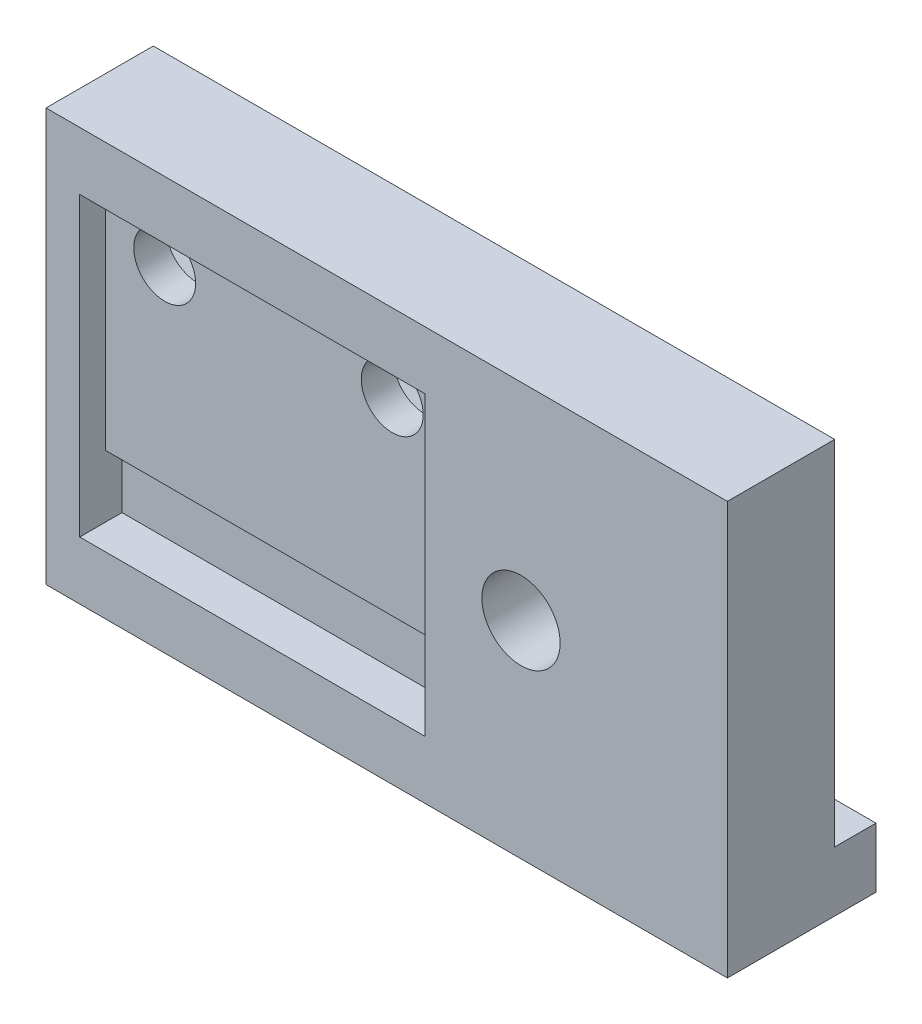
from build123d import *
from build123d.topology import SkipClean

# Parameters (mm, degrees)
SKETCH1_W           = 41.925
SKETCH1_H           = 25.4
SKETCH1_R           = 1.9039967
SKETCH1_R_2         = 2.40665
BOSS_EXTRUDE1_DEPTH = 2
SKETCH2_W           = 41.925
SKETCH2_H           = 25.4
SKETCH2_R           = 2.40665
SKETCH2_W_2         = 21.254
SKETCH2_H_2         = 18.254
BOSS_EXTRUDE2_DEPTH = 1.6
BOSS_EXTRUDE3_START = 3
SKETCH3_W           = 41.925
SKETCH3_H           = 25.4
SKETCH3_R           = 2.40665
BOSS_EXTRUDE3_DEPTH = 3
SKETCH4_W           = 41.925
SKETCH4_H           = 3.683
BOSS_EXTRUDE4_DEPTH = 2.54
SKETCH5_W           = 21.254
SKETCH5_H           = 3.81
CUT_EXTRUDE1_DEPTH  = 1


with BuildPart() as part:
    # Sketch1 → Boss-Extrude1 (new body)
    with BuildSketch(Plane.XY):
        with Locations((20.9625, 12.7)):
            Rectangle(SKETCH1_W, SKETCH1_H)
        with Locations((5.7, 19.05)):
            Circle(SKETCH1_R, mode=Mode.SUBTRACT)
        with Locations((19.7, 19.05)):
            Circle(SKETCH1_R, mode=Mode.SUBTRACT)
        with Locations((29.225, 12.7)):
            Circle(SKETCH1_R_2, mode=Mode.SUBTRACT)
    extrude(amount=BOSS_EXTRUDE1_DEPTH)

    # Sketch2 → Boss-Extrude2 (add)
    with BuildSketch(Plane.XY.offset(2)):
        with Locations((20.9625, 12.7)):
            Rectangle(SKETCH2_W, SKETCH2_H)
        with Locations((29.225, 12.7)):
            Circle(SKETCH2_R, mode=Mode.SUBTRACT)
        with Locations((12.7, 12.7)):
            Rectangle(SKETCH2_W_2, SKETCH2_H_2, mode=Mode.SUBTRACT)
    extrude(amount=BOSS_EXTRUDE2_DEPTH)

    # Sketch3 → Boss-Extrude3 (add)
    with SkipClean():  # the faces are left unmerged after this step: merging them gives an invalid solid
        with BuildSketch(Plane(origin=(0, 0, 0), x_dir=(-1, 0, 0), z_dir=(0, 0, -1)).offset(BOSS_EXTRUDE3_START)):
            with Locations((-20.9625, 12.7)):
                Rectangle(SKETCH3_W, SKETCH3_H)
            with Locations((-29.225, 12.7)):
                Circle(SKETCH3_R, mode=Mode.SUBTRACT)
            Polygon((-16.5690055, 17.242319483), (-16.5690055, 20.857680517), (-19.7, 22.665361035), (-22.8309945, 20.857680517), (-22.8309945, 17.242319483), (-19.7, 15.434638965), align=None, mode=Mode.SUBTRACT)
            Polygon((-2.5690055, 20.857680517), (-5.7, 22.665361035), (-8.8309945, 20.857680517), (-8.8309945, 17.242319483), (-5.7, 15.434638965), (-2.5690055, 17.242319483), align=None, mode=Mode.SUBTRACT)
        extrude(amount=-BOSS_EXTRUDE3_DEPTH)

    # Sketch4 → Boss-Extrude4 (add)
    with SkipClean():  # the faces are left unmerged after this step: merging them gives an invalid solid
        with BuildSketch(Plane(origin=(0, 0, -3), x_dir=(-1, 0, 0), z_dir=(0, 0, -1))):
            with Locations((-20.9625, 1.8415)):
                Rectangle(SKETCH4_W, SKETCH4_H)
        extrude(amount=BOSS_EXTRUDE4_DEPTH)

    # Sketch5 → Cut-Extrude1 (cut)
    with SkipClean():  # the faces are left unmerged after this step: merging them gives an invalid solid
        with BuildSketch(Plane.XY.offset(2)):
            with Locations((12.7, 5.478)):
                Rectangle(SKETCH5_W, SKETCH5_H)
        extrude(amount=-CUT_EXTRUDE1_DEPTH, mode=Mode.SUBTRACT)


solid = part.part
